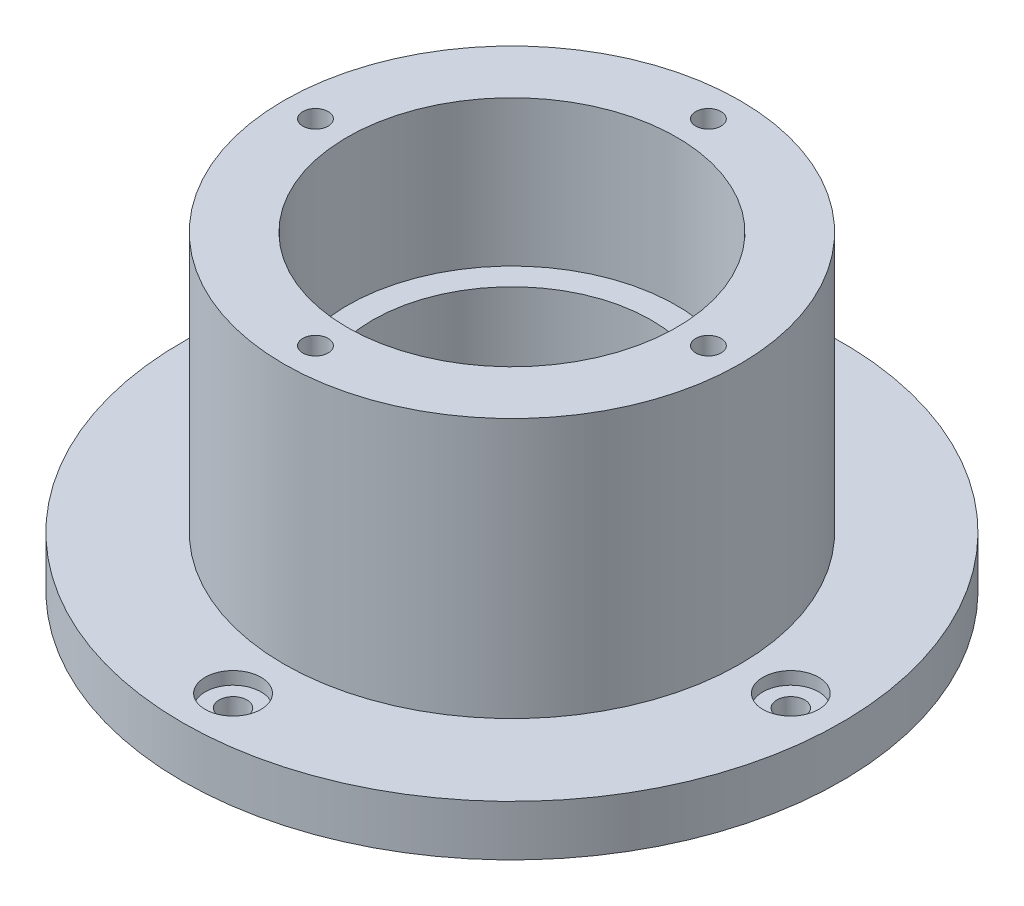
from build123d import *

# Parameters (mm, degrees)
SKETCH_1_R          = 26
EXTRUDE_1_DEPTH     = 4
SKETCH_2_R          = 18
EXTRUDE_2_DEPTH     = 20.5
SKETCH_3_R          = 13
CUT_EXTRUDE_1_DEPTH = 11.5
SKETCH_4_R          = 2.2
CUT_EXTRUDE_2_DEPTH = 1
SKETCH_5_R          = 1.1
CUT_EXTRUDE_3_DEPTH = 43.09809972
SKETCH_6_R          = 11
CUT_EXTRUDE_4_DEPTH = 40
SKETCH_7_R          = 1
CUT_EXTRUDE_5_DEPTH = 5


with BuildPart() as part:
    # Эскиз1 → Бобышка-Вытянуть1 (new body)
    with BuildSketch(Plane(origin=(0, 0, 0), x_dir=(1, 0, 0), z_dir=(0, 1, 0))):
        with Locations(Location((0, 0, 0), (0, 0, 270))):
            Circle(SKETCH_1_R)
    extrude(amount=EXTRUDE_1_DEPTH)

    # Эскиз2 → Бобышка-Вытянуть2 (add)
    with BuildSketch(Plane(origin=(0, 4, 0), x_dir=(1, 0, 0), z_dir=(0, 1, 0))):
        with Locations(Location((0, 0, 0), (0, 0, 270))):
            Circle(SKETCH_2_R)
    extrude(amount=EXTRUDE_2_DEPTH)

    # Эскиз3 → Вырез-Вытянуть1 (cut)
    with BuildSketch(Plane(origin=(0, 24.5, 0), x_dir=(1, 0, 0), z_dir=(0, 1, 0))):
        with Locations(Location((0, 0, 0), (0, 0, 270))):
            Circle(SKETCH_3_R)
    extrude(amount=-CUT_EXTRUDE_1_DEPTH, mode=Mode.SUBTRACT)

    # Эскиз4 → Вырез-Вытянуть2 (cut)
    with BuildSketch(Plane(origin=(0, 4, 0), x_dir=(1, 0, 0), z_dir=(0, 1, 0))):
        with Locations(Location((-22, 0, 0), (0, 0, 270))):
            Circle(SKETCH_4_R)
        with Locations(Location((0, 22, 0), (0, 0, 270))):
            Circle(SKETCH_4_R)
        with Locations(Location((22, 0, 0), (0, 0, 270))):
            Circle(SKETCH_4_R)
        with Locations(Location((0, -22, 0), (0, 0, 270))):
            Circle(SKETCH_4_R)
    extrude(amount=-CUT_EXTRUDE_2_DEPTH, mode=Mode.SUBTRACT)

    # Эскиз5 → Вырез-Вытянуть3 (cut, through all)
    with BuildSketch(Plane(origin=(0, 4, 0), x_dir=(1, 0, 0), z_dir=(0, 1, 0))):
        with Locations(Location((-22, 0, 0), (0, 0, 270))):
            Circle(SKETCH_5_R)
        with Locations(Location((0, 22, 0), (0, 0, 270))):
            Circle(SKETCH_5_R)
        with Locations(Location((22, 0, 0), (0, 0, 270))):
            Circle(SKETCH_5_R)
        with Locations(Location((0, -22, 0), (0, 0, 270))):
            Circle(SKETCH_5_R)
    extrude(amount=-CUT_EXTRUDE_3_DEPTH, mode=Mode.SUBTRACT)

    # Эскиз6 → Вырез-Вытянуть4 (cut, through all)
    with BuildSketch(Plane(origin=(0, 13, 0), x_dir=(1, 0, 0), z_dir=(0, 1, 0))):
        with Locations(Location((0, 0, 0), (0, 0, 270))):
            Circle(SKETCH_6_R)
    extrude(amount=-CUT_EXTRUDE_4_DEPTH, mode=Mode.SUBTRACT)

    # Эскиз7 → Вырез-Вытянуть5 (cut)
    with BuildSketch(Plane(origin=(0, 24.5, 0), x_dir=(1, 0, 0), z_dir=(0, 1, 0))):
        with Locations(Location((-15.5, 0, 0), (0, 0, 270))):
            Circle(SKETCH_7_R)
        with Locations(Location((0, 15.5, 0), (0, 0, 270))):
            Circle(SKETCH_7_R)
        with Locations(Location((15.5, 0, 0), (0, 0, 270))):
            Circle(SKETCH_7_R)
        with Locations(Location((0, -15.5, 0), (0, 0, 270))):
            Circle(SKETCH_7_R)
    extrude(amount=-CUT_EXTRUDE_5_DEPTH, mode=Mode.SUBTRACT)


solid = part.part
